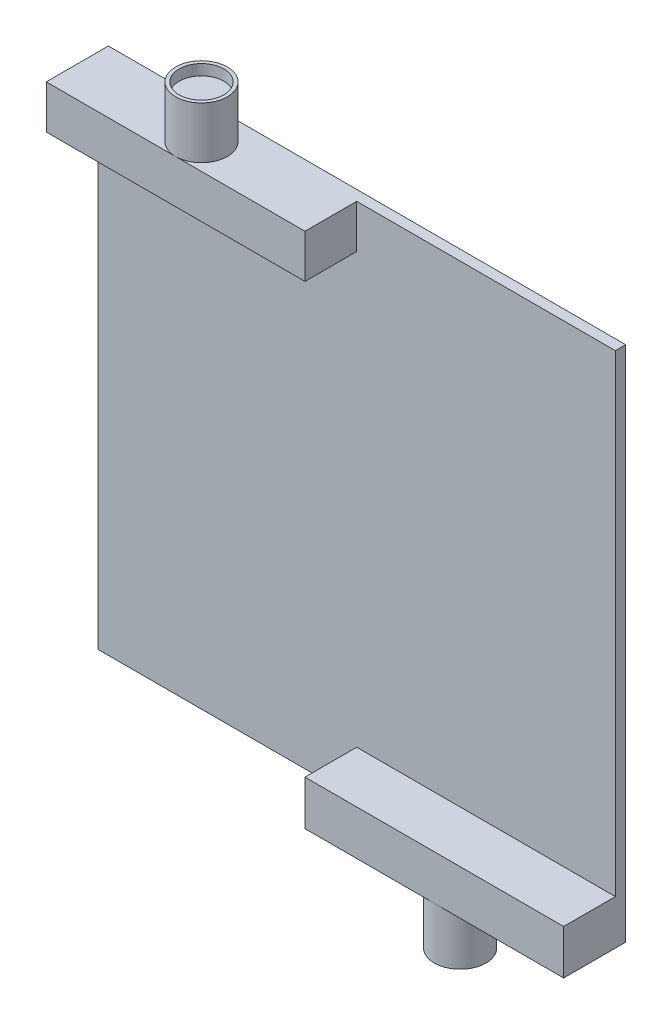
from build123d import *

# Parameters (mm, degrees)
SKETCH1_W           = 150
SKETCH1_H           = 150
BOSS_EXTRUDE1_DEPTH = 3
SKETCH2_R           = 7.5
BOSS_EXTRUDE2_DEPTH = 15
SKETCH4_R           = 7.5
BOSS_EXTRUDE3_DEPTH = 15
SKETCH8_R           = 6.5
CUT_EXTRUDE1_DEPTH  = 3.1
SKETCH9_R           = 6.5
CUT_EXTRUDE2_DEPTH  = 3.1
SKETCH10_W          = 75
SKETCH10_H          = 12.59609842
SKETCH10_H_2        = 12.940455582
BOSS_EXTRUDE4_DEPTH = 15


with BuildPart() as part:
    # Sketch1 → Boss-Extrude1 (new body)
    with BuildSketch(Plane.XY):
        Rectangle(SKETCH1_W, SKETCH1_H)
    extrude(amount=BOSS_EXTRUDE1_DEPTH)



with BuildPart() as body_2:
    # Sketch2 → Boss-Extrude2 (new body)
    with BuildSketch(Plane.XZ.offset(75)):
        with Locations(Location((37.5, 10.5, 0), (0, 0, 270))):
            Circle(SKETCH2_R)
    extrude(amount=BOSS_EXTRUDE2_DEPTH)

    # Sketch8 → Cut-Extrude1 (cut)
    with BuildSketch(Plane.XZ.offset(90)):
        with Locations(Location((37.5, 10.5, 0), (0, 0, 270))):
            Circle(SKETCH8_R)
    extrude(amount=-CUT_EXTRUDE1_DEPTH, mode=Mode.SUBTRACT)


with BuildPart() as body_3:
    # Sketch4 → Boss-Extrude3 (new body)
    with BuildSketch(Plane(origin=(0, 75, 0), x_dir=(1, 0, 0), z_dir=(0, 1, 0))):
        with Locations(Location((-37.5, -10.5, 0), (0, 0, 270))):
            Circle(SKETCH4_R)
    extrude(amount=BOSS_EXTRUDE3_DEPTH)

    # Sketch9 → Cut-Extrude2 (cut)
    with BuildSketch(Plane(origin=(0, 90, 0), x_dir=(1, 0, 0), z_dir=(0, 1, 0))):
        with Locations(Location((-37.5, -10.5, 0), (0, 0, 270))):
            Circle(SKETCH9_R)
    extrude(amount=-CUT_EXTRUDE2_DEPTH, mode=Mode.SUBTRACT)


with BuildPart() as part_1:
    add(part.part)

    add(body_2.part)  # Boss-Extrude4 merges body 2

    add(body_3.part)  # Boss-Extrude4 merges body 3
    # Sketch10 → Boss-Extrude4 (add)
    with BuildSketch(Plane.XY.offset(3)):
        with Locations((-37.5, 68.70195079)):
            Rectangle(SKETCH10_W, SKETCH10_H)
        with Locations((37.5, -68.529772209)):
            Rectangle(SKETCH10_W, SKETCH10_H_2)
    extrude(amount=BOSS_EXTRUDE4_DEPTH)


solid = part_1.part
